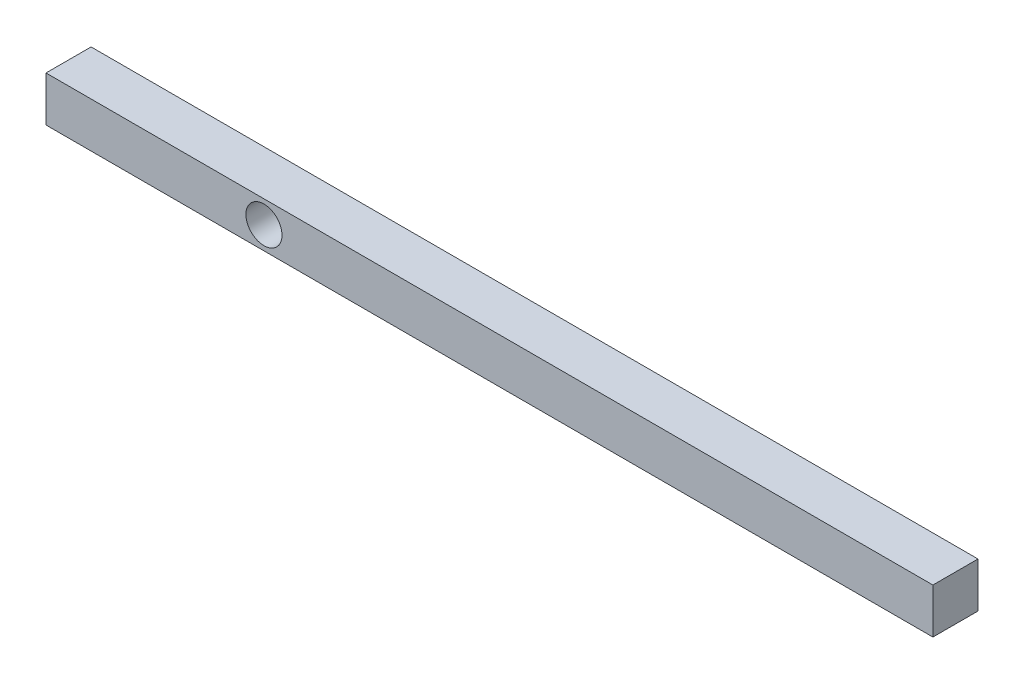
from build123d import *

# Parameters (mm, degrees)
SKETCH1_W           = 236
SKETCH1_H           = 12
BOSS_EXTRUDE1_DEPTH = 6
SKETCH2_R           = 4.8
CUT_EXTRUDE1_DEPTH  = 12


with BuildPart() as part:
    # Sketch1 → Boss-Extrude1 (new, symmetric)
    with BuildSketch(Plane.XY):
        with Locations((60, 0)):
            Rectangle(SKETCH1_W, SKETCH1_H)
    extrude(amount=BOSS_EXTRUDE1_DEPTH, both=True)

    # Sketch2 → Cut-Extrude1 (cut, symmetric)
    with BuildSketch(Plane.XY):
        Circle(SKETCH2_R)
    extrude(amount=CUT_EXTRUDE1_DEPTH, both=True, mode=Mode.SUBTRACT)


solid = part.part
